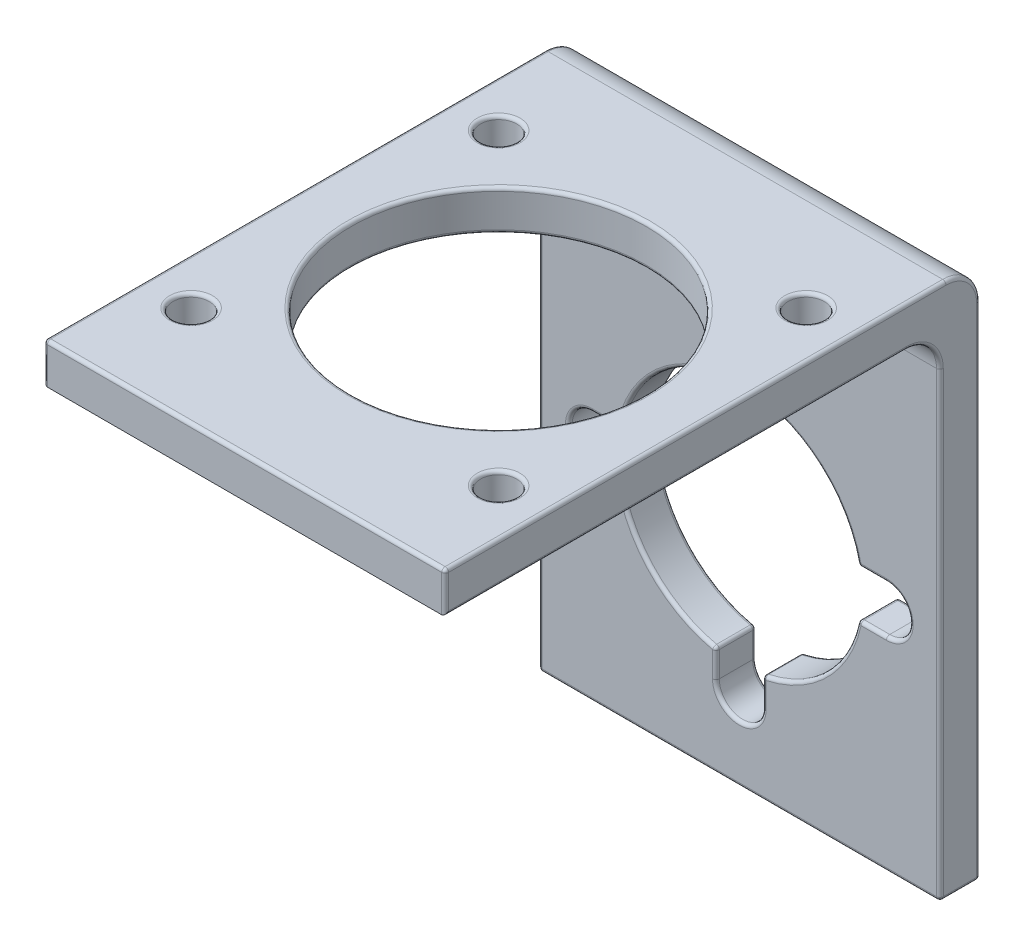
from build123d import *

# Parameters (mm, degrees)
SKETCH1_W              = 30
SKETCH1_H              = 40
BOSS_EXTRUDE1_DEPTH    = 3
SKETCH2_W              = 30
SKETCH2_H              = 3
BOSS_EXTRUDE2_DEPTH    = 37
SKETCH3_R              = 11.05
CUT_EXTRUDE1_DEPTH     = 63.20128616
M2_5_CLEARANCE_HOLE1_D = 2.7
CUT_EXTRUDE2_DEPTH     = 63.20128616
FILLET1_R              = 2.54
FILLET2_R              = 0.254


with BuildPart() as part:
    # Sketch1 → Boss-Extrude1 (new body)
    with BuildSketch(Plane.XY):
        with Locations((15, 20)):
            Rectangle(SKETCH1_W, SKETCH1_H)
    extrude(amount=BOSS_EXTRUDE1_DEPTH)

    # Sketch2 → Boss-Extrude2 (add)
    with BuildSketch(Plane.XY.offset(3)):
        with Locations((15, 38.5)):
            Rectangle(SKETCH2_W, SKETCH2_H)
    extrude(amount=BOSS_EXTRUDE2_DEPTH)

    # Sketch3 → Cut-Extrude1 (cut, through all)
    with BuildSketch(Plane(origin=(0, 37, 0), x_dir=(-1, 0, 0), z_dir=(0, -1, 0))):
        with Locations(Location((-15, -21, 0), (0, 0, 90))):
            Circle(SKETCH3_R)
    extrude(amount=-CUT_EXTRUDE1_DEPTH, mode=Mode.SUBTRACT)

    # M2.5 Clearance Hole1 (through all)
    with Locations(Plane(origin=(0, 40, 0), x_dir=(1, 0, 0), z_dir=(0, 1, 0))):
        with Locations((26.5, -32.5), (3.5, -9.5), (3.5, -32.5), (26.5, -9.5)):
            Hole(M2_5_CLEARANCE_HOLE1_D / 2)

    # Sketch6 → Cut-Extrude2 (cut, through all)
    with BuildSketch(Plane.XY.offset(3)):
        with BuildLine():
            Line((26, 18.73), (23.899573023, 18.73))
            ThreePointArc((23.899573023, 18.73), (21.413458505, 23.393458505), (16.75, 25.879573023))
            Line((16.75, 25.879573023), (16.75, 27.98))
            ThreePointArc((16.75, 27.98), (15, 29.73), (13.25, 27.98))
            Line((13.25, 27.98), (13.25, 25.879573023))
            ThreePointArc((13.25, 25.879573023), (8.586541495, 23.393458505), (6.100426977, 18.73))
            Line((6.100426977, 18.73), (4, 18.73))
            ThreePointArc((4, 18.73), (2.25, 16.98), (4, 15.23))
            Line((4, 15.23), (6.100426977, 15.23))
            ThreePointArc((6.100426977, 15.23), (8.586541495, 10.566541495), (13.25, 8.080426977))
            Line((13.25, 8.080426977), (13.25, 5.98))
            ThreePointArc((13.25, 5.98), (15, 4.23), (16.75, 5.98))
            Line((16.75, 5.98), (16.75, 8.080426977))
            ThreePointArc((16.75, 8.080426977), (21.413458505, 10.566541495), (23.899573023, 15.23))
            Line((23.899573023, 15.23), (26, 15.23))
            ThreePointArc((26, 15.23), (27.75, 16.98), (26, 18.73))
        make_face()
    extrude(amount=-CUT_EXTRUDE2_DEPTH, mode=Mode.SUBTRACT)

    # Fillet1
    fillet1_edges = [part.edges().sort_by_distance(p)[0] for p in [
        (15, 37, 3),
        (15, 40, 0),
    ]]
    fillet(fillet1_edges, radius=FILLET1_R)

    # Fillet2
    fillet2_edges = [part.edges().sort_by_distance(p)[0] for p in [
        (30, 17.23, 3),
        (0, 17.23, 3),
        (0, 18.73, 0),
        (0, 39.256051224, 0.743948776),
        (30, 39.256051224, 0.743948776),
        (30, 36.256051224, 3.743948776),
        (0, 36.256051224, 3.743948776),
        (0, 37, 22.77),
        (30, 37, 22.77),
        (0, 38.5, 40),
        (30, 38.5, 40),
        (15, 40, 40),
        (15, 40, 32.05),
        (15, 37, 32.05),
        (27.85, 37, 9.5),
        (27.85, 40, 9.5),
        (4.85, 37, 32.5),
        (4.85, 40, 32.5),
        (4.85, 37, 9.5),
        (4.85, 40, 9.5),
        (30, 18.73, 0),
        (27.85, 37, 32.5),
        (27.85, 40, 32.5),
        (15, 0, 0),
        (15, 0, 3),
        (8.586541495, 10.566541495, 0),
        (13.25, 8.080426977, 1.5),
        (5.050213488, 15.23, 0),
        (6.100426977, 15.23, 1.5),
        (2.25, 16.98, 0),
        (0, 40, 21.27),
        (5.050213488, 18.73, 0),
        (8.586541495, 23.393458505, 0),
        (6.100426977, 18.73, 1.5),
        (13.25, 26.929786512, 0),
        (30, 40, 21.27),
        (13.25, 25.879573023, 1.5),
        (15, 29.73, 0),
        (16.75, 26.929786512, 0),
        (30, 0, 1.5),
        (21.413458505, 23.393458505, 0),
        (16.75, 25.879573023, 1.5),
        (24.949786512, 18.73, 0),
        (23.899573023, 18.73, 1.5),
        (27.75, 16.98, 0),
        (0, 0, 1.5),
        (24.949786512, 15.23, 0),
        (21.413458505, 10.566541495, 0),
        (23.899573023, 15.23, 1.5),
        (16.75, 7.030213488, 0),
        (16.75, 8.080426977, 1.5),
        (15, 4.23, 0),
        (13.25, 7.030213488, 0),
        (8.586541495, 10.566541495, 3),
        (13.25, 7.030213488, 3),
        (15, 4.23, 3),
        (16.75, 7.030213488, 3),
        (21.413458505, 10.566541495, 3),
        (24.949786512, 15.23, 3),
        (27.75, 16.98, 3),
        (24.949786512, 18.73, 3),
        (21.413458505, 23.393458505, 3),
        (16.75, 26.929786512, 3),
        (15, 29.73, 3),
        (13.25, 26.929786512, 3),
        (8.586541495, 23.393458505, 3),
        (5.050213488, 18.73, 3),
        (2.25, 16.98, 3),
        (5.050213488, 15.23, 3),
    ]]
    fillet(fillet2_edges, radius=FILLET2_R)


solid = part.part
